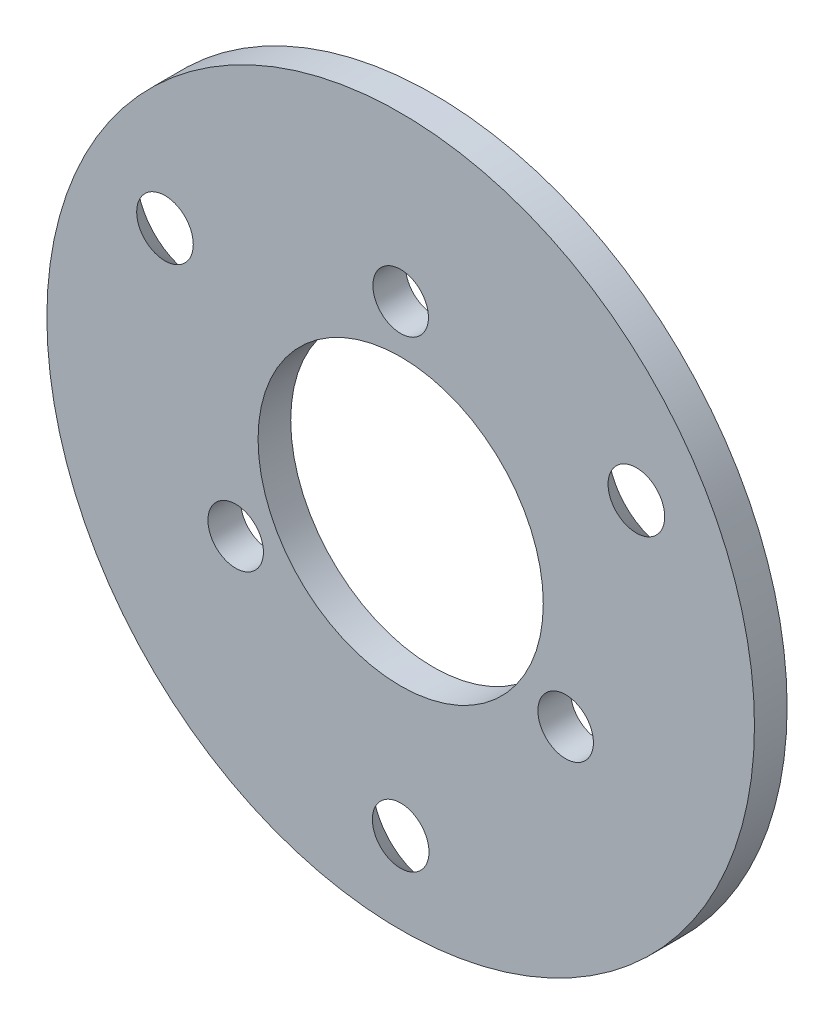
from build123d import *

# Parameters (mm, degrees)
SKETCH_1_R               = 32.5
SKETCH_1_R_2             = 2.55
SKETCH_1_R_3             = 13.1
EXTRUDE_1_DEPTH          = 3
HOLE_WIZARD_1_AT_2_COUNT = 2
HOLE_WIZARD_1_AT_2_PITCH = 43.301270189
HOLE_WIZARD_1_AT_3_COUNT = 2
HOLE_WIZARD_1_AT_3_PITCH = 43.301270189


with BuildPart() as part:
    # 草图1 → 凸台-拉伸1 (new body)
    with BuildSketch(Plane.XY):
        Circle(SKETCH_1_R)
        with Locations((0, 17.5)):
            Circle(SKETCH_1_R_2, mode=Mode.SUBTRACT)
        with Locations((15.155444566, -8.75)):
            Circle(SKETCH_1_R_2, mode=Mode.SUBTRACT)
        with Locations((-15.155444566, -8.75)):
            Circle(SKETCH_1_R_2, mode=Mode.SUBTRACT)
        with Locations((21.650635095, 12.5)):
            Circle(SKETCH_1_R_2, mode=Mode.SUBTRACT)
        with Locations((0, -25)):
            Circle(SKETCH_1_R_2, mode=Mode.SUBTRACT)
        with Locations((-21.650635095, 12.5)):
            Circle(SKETCH_1_R_2, mode=Mode.SUBTRACT)
        Circle(SKETCH_1_R_3, mode=Mode.SUBTRACT)
    extrude(amount=EXTRUDE_1_DEPTH)

    # 草图3 → 打孔尺寸(%根据十字)槽沉头木螺钉的类型1 (revolve, cut)
    with BuildSketch(Plane(origin=(21.650635095, 12.5, 0), x_dir=(0, 1, 0), z_dir=(1, 0, 0))):
        Polygon((0, 0), (0, 3), (2.5, 3), (2.5, 3.1), (5.6, 0), align=None)
    hole_wizard_1 = revolve(axis=Axis((21.650635095, 12.5, -6.35), (0, 0, 1)), mode=Mode.SUBTRACT)

    # 打孔尺寸(%根据十字)槽沉头木螺钉的类型1 at 2: 打孔尺寸(%根据十字)槽沉头木螺钉的类型1 ×2
    with Locations(*[(-i * HOLE_WIZARD_1_AT_2_PITCH, 0, 0) for i in range(1, HOLE_WIZARD_1_AT_2_COUNT)]):
        add(hole_wizard_1, mode=Mode.SUBTRACT)

    # 打孔尺寸(%根据十字)槽沉头木螺钉的类型1 at 3: 打孔尺寸(%根据十字)槽沉头木螺钉的类型1 ×2
    with Locations(*[Vector(-0.5000000000000018, -0.8660254037844376, 0) * (i * HOLE_WIZARD_1_AT_3_PITCH) for i in range(1, HOLE_WIZARD_1_AT_3_COUNT)]):
        add(hole_wizard_1, mode=Mode.SUBTRACT)


solid = part.part
